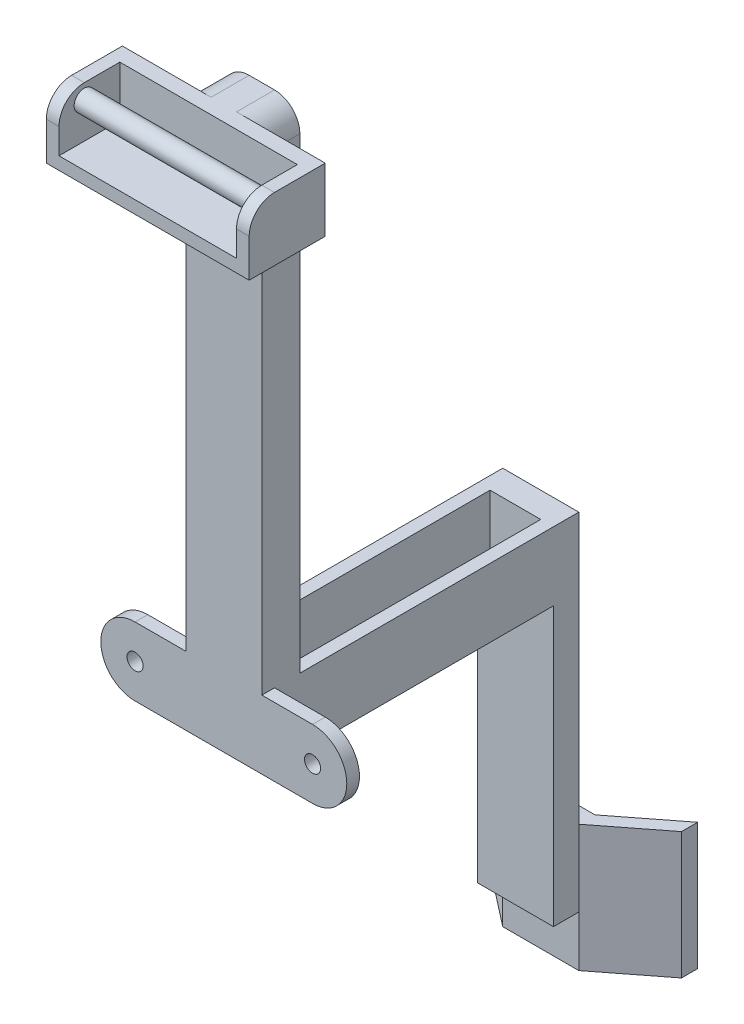
from build123d import *

# Parameters (mm, degrees)
SKETCH1_W                       = 30
SKETCH1_H                       = 194.2
SKETCH1_H_2                     = 27
SKETCH1_H_3                     = 261.4
EXTRUDE1_DEPTH                  = 15
FILLET1_R                       = 10
EXTRUDE2_DEPTH                  = 10
SKETCH3_W                       = 80
SKETCH3_H                       = 25
EXTRUDE3_DEPTH                  = 30
SKETCH5_W                       = 70
SKETCH5_H                       = 20
EXTRUDE4_DEPTH                  = 24
FILLET2_R                       = 10
EXTRUDE5_REACH                  = 432.349
SKETCH6_R                       = 4.029178008
SKETCH7_W                       = 30
SKETCH7_H                       = 263.372286267
EXTRUDE6_DEPTH                  = 427.91910061
EXTRUDE7_DEPTH                  = 100
SKETCH9_W                       = 30
SKETCH9_H                       = 136.58118173
EXTRUDE8_DEPTH                  = 10
F_1_4_0_25_DIAMETER_HOLE1_D     = 6.35
F_1_4_0_25_DIAMETER_HOLE1_DEPTH = 10
F_1_4_0_25_DIAMETER_HOLE1_TIP   = 1.907732465
EXTRUDE12_DEPTH                 = 20
EXTRUDE12_DEPTH_BACK            = 30
SKETCH11_W                      = 15
SKETCH11_H                      = 6.378618897


with BuildPart() as part:
    # Sketch1 → Extrude1 (new body)
    with BuildSketch(Plane.XY):
        with Locations((15, 322.665015772)):
            Rectangle(SKETCH1_W, SKETCH1_H)
        with BuildLine():
            Line((30, 225.565015772), (30, 198.565015772))
            Line((30, 198.565015772), (50, 198.565015772))
            ThreePointArc((50, 198.565015772), (63.5, 212.065015772), (50, 225.565015772))
            Line((50, 225.565015772), (30, 225.565015772))
        make_face()
        with Locations((15, 212.065015772)):
            Rectangle(SKETCH1_W, SKETCH1_H_2)
        with BuildLine():
            Line((-20, 198.565015772), (0, 198.565015772))
            Line((0, 198.565015772), (0, 225.565015772))
            Line((0, 225.565015772), (-20, 225.565015772))
            ThreePointArc((-20, 225.565015772), (-33.5, 212.065015772), (-20, 198.565015772))
        make_face()
        with Locations((15, 67.865015772)):
            Rectangle(SKETCH1_W, SKETCH1_H_3)
    extrude(amount=EXTRUDE1_DEPTH)

    # Fillet1
    fillet1_edges = [part.edges().sort_by_distance(p)[0] for p in [
        (0, 419.765015772, 7.5),
        (30, 419.765015772, 7.5),
        (30, -62.834984228, 7.5),
        (0, -62.834984228, 7.5),
    ]]
    fillet(fillet1_edges, radius=FILLET1_R)

    # Sketch2 → Extrude2 (cut)
    with BuildSketch(Plane(origin=(0, 0, 0), x_dir=(-1, 0, 0), z_dir=(0, 0, -1))):
        with BuildLine():
            Line((-50, 225.565015772), (-30, 225.565015772))
            Line((-30, 225.565015772), (-30, 198.565015772))
            Line((-30, 198.565015772), (-50, 198.565015772))
            ThreePointArc((-50, 198.565015772), (-63.5, 212.065015772), (-50, 225.565015772))
        make_face()
        with BuildLine():
            Line((0, 198.565015772), (20, 198.565015772))
            ThreePointArc((20, 198.565015772), (33.5, 212.065015772), (20, 225.565015772))
            Line((20, 225.565015772), (0, 225.565015772))
            Line((0, 225.565015772), (0, 198.565015772))
        make_face()
    extrude(amount=-EXTRUDE2_DEPTH, mode=Mode.SUBTRACT)

    # Sketch3 → Extrude3 (add)
    with BuildSketch(Plane.XY.offset(15)):
        with Locations((15, 407.265015772)):
            Rectangle(SKETCH3_W, SKETCH3_H)
    extrude(amount=EXTRUDE3_DEPTH)

    # Sketch5 → Extrude4 (cut)
    with BuildSketch(Plane.XY.offset(45)):
        with Locations((15, 409.765015772)):
            Rectangle(SKETCH5_W, SKETCH5_H)
    extrude(amount=-EXTRUDE4_DEPTH, mode=Mode.SUBTRACT)

    # Fillet2
    fillet2_edges = [part.edges().sort_by_distance(p)[0] for p in [
        (52.5, 419.765015772, 45),
        (-22.5, 419.765015772, 45),
    ]]
    fillet(fillet2_edges, radius=FILLET2_R)

    # Sketch6 → Extrude5 (add, up to next)
    with BuildSketch(Plane.ZY.offset(-50), mode=Mode.PRIVATE) as extrude5_sk1:
        with Locations(Location((35, 413.847695375, 0), (0, 0, 180))):
            Circle(SKETCH6_R)
    extrude5_tool1 = extrude(extrude5_sk1.sketch, amount=EXTRUDE5_REACH, mode=Mode.PRIVATE) - part.part
    add(extrude5_tool1.solids().sort_by_distance((50, 413.847695, 35))[0])

    # Sketch7 → Extrude6 (cut, through all)
    with BuildSketch(Plane(origin=(0, 0, 0), x_dir=(-1, 0, 0), z_dir=(0, 0, -1))):
        with Locations((-15, 66.878872639)):
            Rectangle(SKETCH7_W, SKETCH7_H)
    extrude(amount=-EXTRUDE6_DEPTH, mode=Mode.SUBTRACT)

    # Sketch8 → Extrude7 (add)
    with BuildSketch(Plane(origin=(0, 0, 0), x_dir=(-1, 0, 0), z_dir=(0, 0, -1))):
        Polygon((-30, 198.565015772), (0, 198.565015772), (0, 225.565015772), (-5, 225.565015772), (-5, 203.565015772), (-25, 203.565015772), (-25, 225.565015772), (-30, 225.565015772), align=None)
    extrude(amount=EXTRUDE7_DEPTH)

    # Sketch9 → Extrude8 (add)
    with BuildSketch(Plane(origin=(0, 0, -100), x_dir=(-1, 0, 0), z_dir=(0, 0, -1))):
        with Locations((-15, 157.274424907)):
            Rectangle(SKETCH9_W, SKETCH9_H)
    extrude(amount=EXTRUDE8_DEPTH)

    # 1/4 (0.25) Diameter Hole1
    with Locations(Plane(origin=(-20, 212.065015772, 10), x_dir=(-1, 0, 0), z_dir=(0, 0, -1))):
        with Locations((0, 0), (-70, 0)):
            Hole(F_1_4_0_25_DIAMETER_HOLE1_D / 2, depth=F_1_4_0_25_DIAMETER_HOLE1_DEPTH)
            with Locations((0, 0, -(F_1_4_0_25_DIAMETER_HOLE1_DEPTH + F_1_4_0_25_DIAMETER_HOLE1_TIP / 2))):  # 118° drill point
                Cone(0, F_1_4_0_25_DIAMETER_HOLE1_D / 2, F_1_4_0_25_DIAMETER_HOLE1_TIP, mode=Mode.SUBTRACT)

    # Sketch11 → Extrude12 (add, two sides: drawn at the far end of the back side and taken through both)
    with BuildSketch(Plane.XZ.offset(-88.983834042).offset(-EXTRUDE12_DEPTH_BACK)):
        Polygon((0, -116.378618897), (-22.784065685, -134.102681991), (-22.784065685, -127.724063095), (0, -110), align=None)
        with Locations((22.5, -113.189309449)):
            Rectangle(SKETCH11_W, SKETCH11_H)
        with Locations((7.5, -113.189309449)):
            Rectangle(SKETCH11_W, SKETCH11_H)
        Polygon((30, -116.378618897), (52.784065685, -134.102681991), (52.784065685, -127.724063095), (30, -110), align=None)
    extrude(amount=EXTRUDE12_DEPTH + EXTRUDE12_DEPTH_BACK)


solid = part.part
